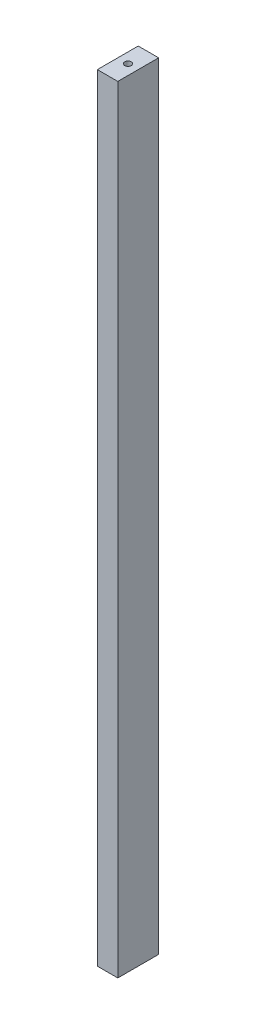
from build123d import *

# Parameters (mm, degrees)
SKETCH_1_W          = 25
SKETCH_1_H          = 50
EXTRUDE_1_DEPTH     = 950
SKETCH_2_R          = 4
CUT_EXTRUDE_1_DEPTH = 50
CUT_EXTRUDE_START   = -50
SKETCH_3_R          = 4
CUT_EXTRUDE_2_DEPTH = 50


with BuildPart() as part:
    # Эскиз1 → Бобышка-Вытянуть1 (new body)
    with BuildSketch(Plane(origin=(0, 0, 0), x_dir=(1, 0, 0), z_dir=(0, 1, 0))):
        Rectangle(SKETCH_1_W, SKETCH_1_H)
    extrude(amount=EXTRUDE_1_DEPTH)

    # Эскиз2 → Вырез-Вытянуть1 (cut)
    with BuildSketch(Plane.XZ):
        with Locations(Location((0, 0, 0), (0, 0, 270))):
            Circle(SKETCH_2_R)
    extrude(amount=-CUT_EXTRUDE_1_DEPTH, mode=Mode.SUBTRACT)

    # Эскиз3 → Вырез-Вытянуть2 (cut)
    with BuildSketch(Plane(origin=(0, 950, 0), x_dir=(1, 0, 0), z_dir=(0, 1, 0)).offset(CUT_EXTRUDE_START)):
        with Locations(Location((0, 0, 0), (0, 0, 90))):
            Circle(SKETCH_3_R)
    extrude(amount=CUT_EXTRUDE_2_DEPTH, mode=Mode.SUBTRACT)


solid = part.part
